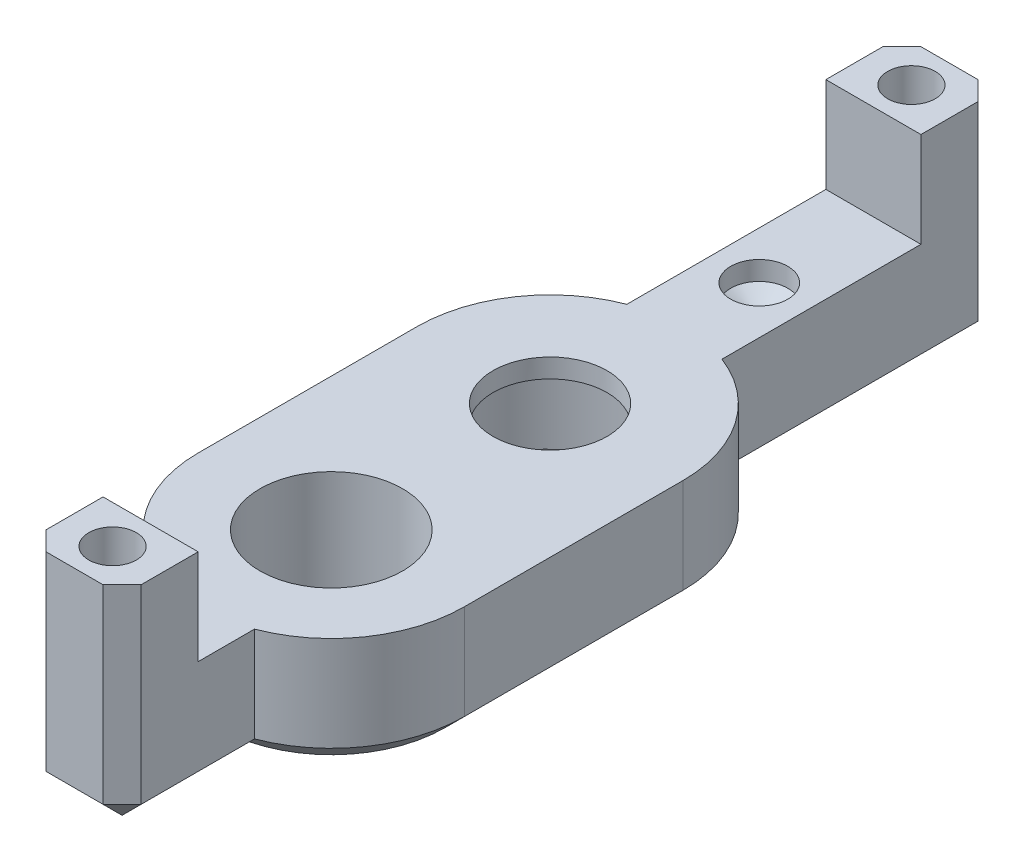
from build123d import *

# Parameters (mm, degrees)
ESBO_O2_W                                   = 14
ESBO_O2_H                                   = 46
RESSALTO_EXTRUS_O1_DEPTH                    = 6
CORTE_EXTRUS_O1_DEPTH                       = 49.456165758
FURO_DE_DI_METRO_7_5_7_5_1_D                = 7.5
CORTE_EXTRUS_O2_DEPTH                       = 49.456165758
ESBO_O10_W                                  = 5
ESBO_O10_H                                  = 4
RESSALTO_EXTRUS_O2_DEPTH                    = 5
BROCA_DE_ROSQUEAR_PARA_TARRAXA_DE_M31_D     = 2.5
BROCA_DE_ROSQUEAR_PARA_TARRAXA_DE_M31_DEPTH = 4
BROCA_DE_ROSQUEAR_PARA_TARRAXA_DE_M31_TIP   = 0.751075774
FURO_DE_DI_METRO_6_0_6_1_D                  = 6
CHANFRO1_SIZE                               = 1
FURO_DE_DI_METRO_3_0_3_1_D                  = 3
FURO_DE_DI_METRO_3_0_3_1_DEPTH              = 1
FURO_DE_DI_METRO_3_0_3_1_TIP                = 0.901290929
ESBO_O14_R                                  = 5.55
CORTE_EXTRUS_O4_DEPTH                       = 5


with BuildPart() as part:
    # Esboço2 → Ressalto-extrusão1 (new body)
    with BuildSketch(Plane(origin=(0, 0, 0), x_dir=(1, 0, 0), z_dir=(0, 1, 0))):
        with Locations((7, 23)):
            Rectangle(ESBO_O2_W, ESBO_O2_H)
    extrude(amount=RESSALTO_EXTRUS_O1_DEPTH)

    # Esboço6 → Corte-extrusão1 (cut, through all)
    with BuildSketch(Plane(origin=(0, 6, 0), x_dir=(1, 0, 0), z_dir=(0, 1, 0))):
        with BuildLine():
            Line((4.5, 46), (4.5, 31.538348415))
            ThreePointArc((4.5, 31.538348415), (1.233718703, 28.968626967), (0, 25))
            Line((0, 25), (0, 46))
            Line((0, 46), (4.5, 46))
        make_face()
        with BuildLine():
            Line((9.5, 46), (9.5, 31.538348415))
            ThreePointArc((9.5, 31.538348415), (12.766281297, 28.968626967), (14, 25))
            Line((14, 25), (14, 46))
            Line((14, 46), (9.5, 46))
        make_face()
    extrude(amount=-CORTE_EXTRUS_O1_DEPTH, mode=Mode.SUBTRACT)

    # Furo de diâmetro Ø7.5 (7.5)1 (through all)
    with Locations(Plane(origin=(7, 6, -13.5), x_dir=(0, 0, 1), z_dir=(0, 1, 0))):
        with Locations((0, 0)):
            Hole(FURO_DE_DI_METRO_7_5_7_5_1_D / 2)

    # Esboço9 → Corte-extrusão2 (cut, through all)
    with BuildSketch(Plane(origin=(0, 6, 0), x_dir=(1, 0, 0), z_dir=(0, 1, 0))):
        with BuildLine():
            Line((0, 13.5), (0, 0))
            Line((0, 0), (4.5, 0))
            Line((4.5, 0), (4.5, 6.961651585))
            ThreePointArc((4.5, 6.961651585), (1.233718703, 9.531373033), (0, 13.5))
        make_face()
        with BuildLine():
            Line((9.5, 0), (9.5, 6.961651585))
            ThreePointArc((9.5, 6.961651585), (12.766281297, 9.531373033), (14, 13.5))
            Line((14, 13.5), (14, 0))
            Line((14, 0), (9.5, 0))
        make_face()
    extrude(amount=-CORTE_EXTRUS_O2_DEPTH, mode=Mode.SUBTRACT)

    # Esboço10 → Ressalto-extrusão2 (add)
    with BuildSketch(Plane(origin=(0, 6, 0), x_dir=(1, 0, 0), z_dir=(0, 1, 0))):
        with Locations((7, 44)):
            Rectangle(ESBO_O10_W, ESBO_O10_H)
        with Locations((7, 2)):
            Rectangle(ESBO_O10_W, ESBO_O10_H)
    extrude(amount=RESSALTO_EXTRUS_O2_DEPTH)

    # Broca de rosquear para tarraxa de M31
    with Locations(Plane(origin=(7, 11, -2), x_dir=(0, 0, 1), z_dir=(0, 1, 0))):
        with Locations((0, 0), (-42, 0)):
            Hole(BROCA_DE_ROSQUEAR_PARA_TARRAXA_DE_M31_D / 2, depth=BROCA_DE_ROSQUEAR_PARA_TARRAXA_DE_M31_DEPTH)
            with Locations((0, 0, -(BROCA_DE_ROSQUEAR_PARA_TARRAXA_DE_M31_DEPTH + BROCA_DE_ROSQUEAR_PARA_TARRAXA_DE_M31_TIP / 2))):  # 118° drill point
                Cone(0, BROCA_DE_ROSQUEAR_PARA_TARRAXA_DE_M31_D / 2, BROCA_DE_ROSQUEAR_PARA_TARRAXA_DE_M31_TIP, mode=Mode.SUBTRACT)

    # Furo de diâmetro Ø6.0 (6)1 (through all)
    with Locations(Plane(origin=(7, 6, -25), x_dir=(0, 0, 1), z_dir=(0, 1, 0))):
        with Locations((0, 0)):
            Hole(FURO_DE_DI_METRO_6_0_6_1_D / 2)

    # Chanfro1
    chanfro1_edges = [part.edges().sort_by_distance(p)[0] for p in [
        (0, 0, -19.25),
        (7, 0, -46),
        (9.5, 5.5, -46),
        (12.766281297, 0, -28.968626967),
        (9.5, 0, -38.769174208),
        (4.5, 0, -38.769174208),
        (4.5, 5.5, -46),
        (1.233718703, 0, -28.968626967),
        (14, 0, -19.25),
        (7, 0, 0),
        (1.233718703, 0, -9.531373033),
        (4.5, 0, -3.480825792),
        (4.5, 5.5, 0),
        (9.5, 0, -3.480825792),
        (9.5, 5.5, 0),
        (12.766281297, 0, -9.531373033),
    ]]
    chamfer(chanfro1_edges, length=CHANFRO1_SIZE)

    # Furo de diâmetro Ø3.0 (3)1
    with Locations(Plane(origin=(7, 6, -36), x_dir=(0, 0, 1), z_dir=(0, 1, 0))):
        with Locations((0, 0)):
            Hole(FURO_DE_DI_METRO_3_0_3_1_D / 2, depth=FURO_DE_DI_METRO_3_0_3_1_DEPTH)
            with Locations((0, 0, -(FURO_DE_DI_METRO_3_0_3_1_DEPTH + FURO_DE_DI_METRO_3_0_3_1_TIP / 2))):  # 118° drill point
                Cone(0, FURO_DE_DI_METRO_3_0_3_1_D / 2, FURO_DE_DI_METRO_3_0_3_1_TIP, mode=Mode.SUBTRACT)

    # Esboço14 → Corte-extrusão4 (cut)
    with BuildSketch(Plane.XZ):
        with Locations(Location((7, -25, 0), (0, 0, 270))):
            Circle(ESBO_O14_R)
    extrude(amount=-CORTE_EXTRUS_O4_DEPTH, mode=Mode.SUBTRACT)


solid = part.part
